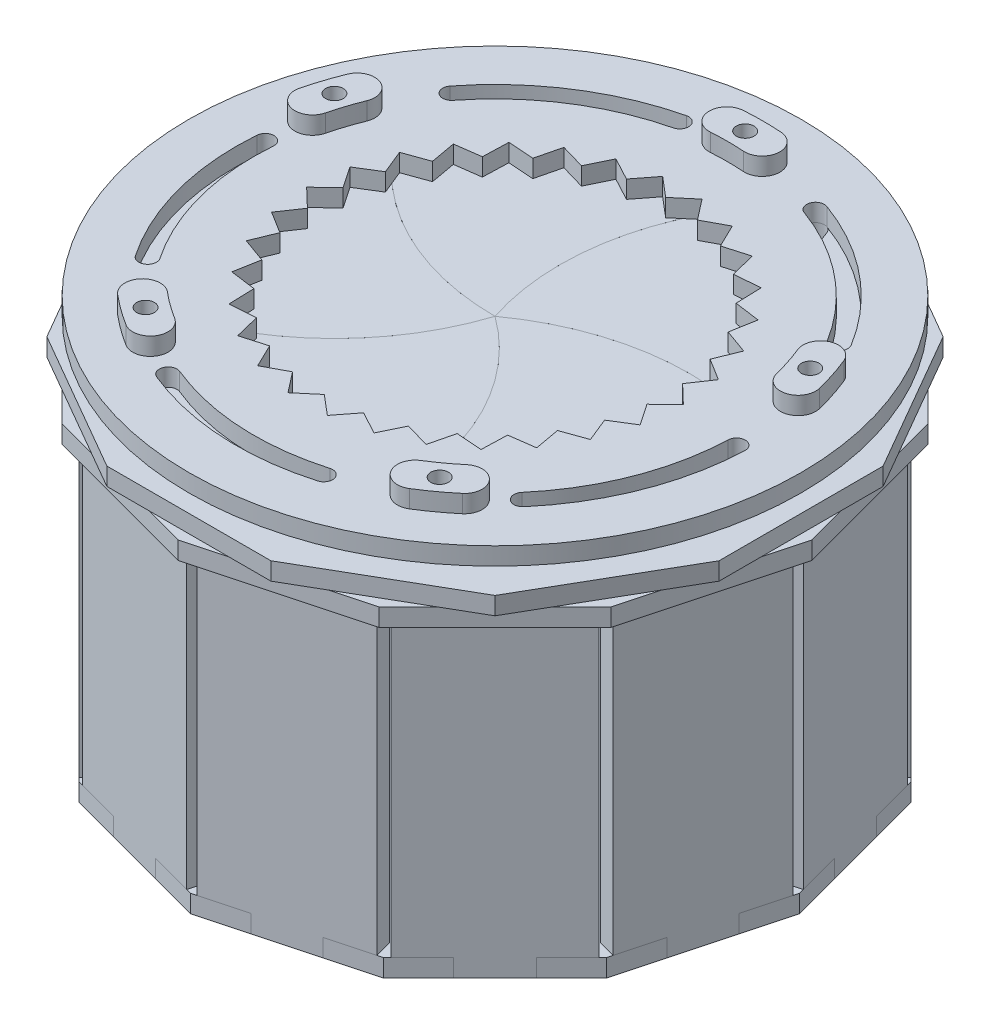
from build123d import *

# Parameters (mm, degrees)
SKETCH4_R             = 1.5
BOSS_EXTRUDE1_DEPTH   = 3
SKETCH5_R             = 52
SKETCH5_R_2           = 1.35
BOSS_EXTRUDE2_DEPTH   = 3
BOSS_EXTRUDE5_START   = -3
SKETCH8_R             = 1.35
SKETCH8_R_2           = 37
BOSS_EXTRUDE5_DEPTH   = 3
BOSS_EXTRUDE6_START   = -6
SKETCH6_R             = 37
SKETCH6_R_2           = 1.35
BOSS_EXTRUDE6_DEPTH   = 3
BOSS_EXTRUDE4_START   = 3
SKETCH7_R             = 1.5
BOSS_EXTRUDE4_DEPTH   = 3
SKETCH9_W             = 25
SKETCH9_H             = 50
SKETCH9_W_2           = 10
SKETCH9_H_2           = 3
BOSS_EXTRUDE7_DEPTH   = 3
CIRPATTERN1_COUNT     = 12
BOSS_EXTRUDE8_START   = -59
BOSS_EXTRUDE8_DEPTH   = 3
CIRPATTERN2_COUNT     = 5
CIRPATTERN3_COUNT     = 5
CUT_EXTRUDE1_START    = -3
CUT_EXTRUDE1_DEPTH    = 6
BOSS_EXTRUDE9_START   = -3
BOSS_EXTRUDE9_DEPTH   = 6
BOSS_EXTRUDE9_2_DEPTH = 6
BOSS_EXTRUDE9_3_DEPTH = 6
BOSS_EXTRUDE9_4_DEPTH = 6
BOSS_EXTRUDE9_5_DEPTH = 6


with BuildPart() as part:
    # Sketch4 → Boss-Extrude1 (new body)
    with BuildSketch(Plane(origin=(0, 0, 0), x_dir=(1, 0, 0), z_dir=(0, 1, 0))):
        with BuildLine():
            ThreePointArc((6.036679682, 38.114095483), (7.460052814, 42.658971774), (5.844359487, 47.139086353))
            ThreePointArc((5.844359487, 47.139086353), (-19.682082188, 43.230378679), (-39.391113444, 26.544117647))
            ThreePointArc((-39.391113444, 26.544117647), (-23.75, 7.25531955), (0, 0))
            ThreePointArc((0, 0), (-1.556852533, 19.781687025), (6.036679682, 38.114095483))
        make_face()
        with Locations(Location((0, 42.5, 0), (0, 0, 270))):
            Circle(SKETCH4_R, mode=Mode.SUBTRACT)
        with BuildLine():
            ThreePointArc((-2.401057807, 37.523065377), (-2.401057807, 39.644385721), (-4.522378151, 39.644385721))
            ThreePointArc((-4.522378151, 39.644385721), (-17.823735452, 30.756702916), (-33.513756179, 27.635763749))
            ThreePointArc((-33.513756179, 27.635763749), (-35.013756179, 26.135763749), (-33.513756179, 24.635763749))
            ThreePointArc((-33.513756179, 24.635763749), (-16.675685155, 27.985064319), (-2.401057807, 37.523065377))
        make_face(mode=Mode.SUBTRACT)
    extrude(amount=-BOSS_EXTRUDE1_DEPTH)


with BuildPart() as body_2:
    # Sketch5 → Boss-Extrude2 (new body)
    with BuildSketch(Plane(origin=(0, 0, 0), x_dir=(1, 0, 0), z_dir=(0, 1, 0))):
        with Locations(Location((0, 0, 0), (0, 0, 270))):
            Circle(SKETCH5_R)
        with Locations(Location((24.980873222, -34.383222261, 0), (0, 0, 270))):
            Circle(SKETCH5_R_2, mode=Mode.SUBTRACT)
        with Locations(Location((40.419901943, 13.133222261, 0), (0, 0, 270))):
            Circle(SKETCH5_R_2, mode=Mode.SUBTRACT)
        with Locations(Location((-24.980873222, -34.383222261, 0), (0, 0, 270))):
            Circle(SKETCH5_R_2, mode=Mode.SUBTRACT)
        with Locations(Location((-40.419901943, 13.133222261, 0), (0, 0, 270))):
            Circle(SKETCH5_R_2, mode=Mode.SUBTRACT)
        with Locations(Location((0, 42.5, 0), (0, 0, 270))):
            Circle(SKETCH5_R_2, mode=Mode.SUBTRACT)
        Polygon((-3.344910825, 31.824700652), (0, 29), (3.344910825, 31.824700652), (6.029439034, 28.366280421), (9.88854382, 30.433808521), (11.795362649, 26.492818272), (16, 27.712812921), (17.045772316, 23.461492837), (21.412179403, 23.780634415), (21.551199939, 19.404787584), (25.88854382, 18.809128073), (25.11473671, 14.5), (29.233454645, 13.015572578), (27.580638973, 8.961492837), (31.300723223, 6.653174106), (28.841134966, 3.031325435), (32, 0), (28.841134966, -3.031325435), (31.300723223, -6.653174106), (27.580638973, -8.961492837), (29.233454645, -13.015572578), (25.11473671, -14.5), (25.88854382, -18.809128073), (21.551199939, -19.404787584), (21.412179403, -23.780634415), (17.045772316, -23.461492837), (16, -27.712812921), (11.795362649, -26.492818272), (9.88854382, -30.433808521), (6.029439034, -28.366280421), (3.344910825, -31.824700652), (0, -29), (-3.344910825, -31.824700652), (-6.029439034, -28.366280421), (-9.88854382, -30.433808521), (-11.795362649, -26.492818272), (-16, -27.712812921), (-17.045772316, -23.461492837), (-21.412179403, -23.780634415), (-21.551199939, -19.404787584), (-25.88854382, -18.809128073), (-25.11473671, -14.5), (-29.233454645, -13.015572578), (-27.580638973, -8.961492837), (-31.300723223, -6.653174106), (-28.841134966, -3.031325435), (-32, 0), (-28.841134966, 3.031325435), (-31.300723223, 6.653174106), (-27.580638973, 8.961492837), (-29.233454645, 13.015572578), (-25.11473671, 14.5), (-25.88854382, 18.809128073), (-21.551199939, 19.404787584), (-21.412179403, 23.780634415), (-17.045772316, 23.461492837), (-16, 27.712812921), (-11.795362649, 26.492818272), (-9.88854382, 30.433808521), (-6.029439034, 28.366280421), align=None, mode=Mode.SUBTRACT)
        with BuildLine():
            ThreePointArc((-9.580064549, 39.865051903), (-22.19911899, 34.47026423), (-32.330917726, 25.213325029))
            ThreePointArc((-32.330917726, 25.213325029), (-34.4361949, 24.952925296), (-34.696594633, 27.05820247))
            ThreePointArc((-34.696594633, 27.05820247), (-23.823444769, 36.992478686), (-10.281044882, 42.78200692))
            ThreePointArc((-10.281044882, 42.78200692), (-8.472077207, 41.674019578), (-9.580064549, 39.865051903))
        make_face(mode=Mode.SUBTRACT)
        with BuildLine():
            ThreePointArc((33.464172761, -28.568324092), (41.0172051, -15.924474427), (43.97454707, -1.496399005))
            ThreePointArc((43.97454707, -1.496399005), (42.526428386, 0.053746884), (40.976282497, -1.3943718))
            ThreePointArc((40.976282497, -1.3943718), (38.22057748, -14.838714807), (31.182524618, -26.620483813))
            ThreePointArc((31.182524618, -26.620483813), (31.34942855, -28.735228024), (33.464172761, -28.568324092))
        make_face(mode=Mode.SUBTRACT)
        with BuildLine():
            ThreePointArc((15.01204239, 41.359866819), (13.090272758, 40.461645532), (13.988494045, 38.5398759))
            ThreePointArc((13.988494045, 38.5398759), (25.923264386, 31.764514219), (34.953514632, 21.430161336))
            ThreePointArc((34.953514632, 21.430161336), (37.016332046, 20.935404508), (37.511088873, 22.998221921))
            ThreePointArc((37.511088873, 22.998221921), (27.82008861, 34.088746966), (15.01204239, 41.359866819))
        make_face(mode=Mode.SUBTRACT)
        with BuildLine():
            ThreePointArc((-43.86512405, 3.442512463), (-42.543787206, -11.22613781), (-36.455717167, -24.636978018))
            ThreePointArc((-36.455717167, -24.636978018), (-34.373011649, -25.03988958), (-33.970100087, -22.957184063))
            ThreePointArc((-33.970100087, -22.957184063), (-39.643074442, -10.460719323), (-40.874320138, 3.207795704))
            ThreePointArc((-40.874320138, 3.207795704), (-42.252363715, 4.82055604), (-43.86512405, 3.442512463))
        make_face(mode=Mode.SUBTRACT)
        with BuildLine():
            ThreePointArc((-15.681654563, -37.882525129), (-2.301648434, -40.935344319), (11.336241271, -39.401645065))
            ThreePointArc((11.336241271, -39.401645065), (13.192505405, -40.428428131), (12.16572234, -42.284692265))
            ThreePointArc((12.16572234, -42.284692265), (-2.470061734, -43.930613415), (-16.829092702, -40.654417212))
            ThreePointArc((-16.829092702, -40.654417212), (-17.641319674, -38.694752101), (-15.681654563, -37.882525129))
        make_face(mode=Mode.SUBTRACT)
    extrude(amount=BOSS_EXTRUDE2_DEPTH)


with BuildPart() as body_3:
    # Sketch8 → Boss-Extrude5 (new body)
    with BuildSketch(Plane(origin=(0, 0, 0), x_dir=(1, 0, 0), z_dir=(0, 1, 0)).offset(BOSS_EXTRUDE5_START)):
        Polygon((13.933358006, 52), (-13.933358006, 52), (-38.066641994, 38.066641994), (-52, 13.933358006), (-52, -13.933358006), (-38.066641994, -38.066641994), (-13.933358006, -52), (13.933358006, -52), (38.066641994, -38.066641994), (52, -13.933358006), (52, 13.933358006), (38.066641994, 38.066641994), align=None)
        with Locations(Location((14.500268217, 39.949871359, 0), (0, 0, 270))):
            Circle(SKETCH8_R, mode=Mode.SUBTRACT)
        with Locations(Location((42.475414784, -1.445385403, 0), (0, 0, 270))):
            Circle(SKETCH8_R, mode=Mode.SUBTRACT)
        with Locations(Location((11.750981805, -40.843168665, 0), (0, 0, 270))):
            Circle(SKETCH8_R, mode=Mode.SUBTRACT)
        with Locations(Location((-35.212908627, -23.79708104, 0), (0, 0, 270))):
            Circle(SKETCH8_R, mode=Mode.SUBTRACT)
        with Locations(Location((-33.513756179, 26.135763749, 0), (0, 0, 270))):
            Circle(SKETCH8_R, mode=Mode.SUBTRACT)
        with Locations(Location((0, 0, 0), (0, 0, 270))):
            Circle(SKETCH8_R_2, mode=Mode.SUBTRACT)
    extrude(amount=-BOSS_EXTRUDE5_DEPTH)


with BuildPart() as body_4:
    # Sketch6 → Boss-Extrude6 (new body)
    with BuildSketch(Plane(origin=(0, 0, 0), x_dir=(1, 0, 0), z_dir=(0, 1, 0)).offset(BOSS_EXTRUDE6_START)):
        Polygon((46.621924553, -26.917180691), (53.834361381, 0), (46.621924553, 26.917180691), (26.917180691, 46.621924553), (0, 53.834361381), (-26.917180691, 46.621924553), (-46.621924553, 26.917180691), (-53.834361381, 0), (-46.621924553, -26.917180691), (-26.917180691, -46.621924553), (0, -53.834361381), (26.917180691, -46.621924553), align=None)
        with Locations(Location((0, 0, 0), (0, 0, 270))):
            Circle(SKETCH6_R, mode=Mode.SUBTRACT)
        with Locations(Location((-33.513756179, 26.135763749, 0), (0, 0, 270))):
            Circle(SKETCH6_R_2, mode=Mode.SUBTRACT)
        with Locations(Location((14.500268217, 39.949871359, 0), (0, 0, 270))):
            Circle(SKETCH6_R_2, mode=Mode.SUBTRACT)
        with Locations(Location((42.475414784, -1.445385403, 0), (0, 0, 270))):
            Circle(SKETCH6_R_2, mode=Mode.SUBTRACT)
        with Locations(Location((11.750981805, -40.843168665, 0), (0, 0, 270))):
            Circle(SKETCH6_R_2, mode=Mode.SUBTRACT)
        with Locations(Location((-35.212908627, -23.79708104, 0), (0, 0, 270))):
            Circle(SKETCH6_R_2, mode=Mode.SUBTRACT)
        Polygon((17.770581387, 47.002196089), (8.111323124, 49.59038654), (7.334865988, 46.692609061), (16.994124251, 44.10441861), align=None, mode=Mode.SUBTRACT)
        Polygon((46.692609061, 7.334865988), (49.59038654, 8.111323124), (47.002196089, 17.770581387), (44.10441861, 16.994124251), align=None, mode=Mode.SUBTRACT)
        Polygon((36.769552622, 29.69848481), (38.890872965, 31.819805153), (31.819805153, 38.890872965), (29.69848481, 36.769552622), align=None, mode=Mode.SUBTRACT)
        Polygon((29.69848481, -36.769552622), (31.819805153, -38.890872965), (38.890872965, -31.819805153), (36.769552622, -29.69848481), align=None, mode=Mode.SUBTRACT)
        Polygon((44.10441861, -16.994124251), (47.002196089, -17.770581387), (49.59038654, -8.111323124), (46.692609061, -7.334865988), align=None, mode=Mode.SUBTRACT)
        Polygon((-36.769552622, -29.69848481), (-38.890872965, -31.819805153), (-31.819805153, -38.890872965), (-29.69848481, -36.769552622), align=None, mode=Mode.SUBTRACT)
        Polygon((-16.994124251, -44.10441861), (-17.770581387, -47.002196089), (-8.111323124, -49.59038654), (-7.334865988, -46.692609061), align=None, mode=Mode.SUBTRACT)
        Polygon((16.994124251, -44.10441861), (7.334865988, -46.692609061), (8.111323124, -49.59038654), (17.770581387, -47.002196089), align=None, mode=Mode.SUBTRACT)
        Polygon((-29.69848481, 36.769552622), (-31.819805153, 38.890872965), (-38.890872965, 31.819805153), (-36.769552622, 29.69848481), align=None, mode=Mode.SUBTRACT)
        Polygon((-44.10441861, 16.994124251), (-47.002196089, 17.770581387), (-49.59038654, 8.111323124), (-46.692609061, 7.334865988), align=None, mode=Mode.SUBTRACT)
        Polygon((-46.692609061, -7.334865988), (-49.59038654, -8.111323124), (-47.002196089, -17.770581387), (-44.10441861, -16.994124251), align=None, mode=Mode.SUBTRACT)
        Polygon((-7.334865988, 46.692609061), (-8.111323124, 49.59038654), (-17.770581387, 47.002196089), (-16.994124251, 44.10441861), align=None, mode=Mode.SUBTRACT)
    extrude(amount=-BOSS_EXTRUDE6_DEPTH)


with BuildPart() as body_5:
    # Sketch7 → Boss-Extrude4 (new body)
    with BuildSketch(Plane(origin=(0, 0, 0), x_dir=(1, 0, 0), z_dir=(0, 1, 0)).offset(BOSS_EXTRUDE4_START)):
        with BuildLine():
            ThreePointArc((3.211764706, 45.386502041), (0, 45.5), (-3.211764706, 45.386502041))
            ThreePointArc((-3.211764706, 45.386502041), (-5.992516618, 42.182220717), (-2.788235294, 39.401468804))
            ThreePointArc((-2.788235294, 39.401468804), (0, 39.5), (2.788235294, 39.401468804))
            ThreePointArc((2.788235294, 39.401468804), (5.992516618, 42.182220717), (3.211764706, 45.386502041))
        make_face()
        with Locations(Location((0, 42.5, 0), (0, 0, 270))):
            Circle(SKETCH7_R, mode=Mode.SUBTRACT)
    extrude(amount=BOSS_EXTRUDE4_DEPTH)


with BuildPart() as body_6:
    # Sketch9 → Boss-Extrude7 (new body)
    with BuildSketch(Plane(origin=(-12.16449512, 0, -45.398513836), x_dir=(-0.9659258262890682, 0, 0.25881904510252124), z_dir=(-0.25881904510252124, 0, -0.9659258262890682))):
        with Locations((0, -34)):
            Rectangle(SKETCH9_W, SKETCH9_H)
        with Locations((0, -7.5)):
            Rectangle(SKETCH9_W_2, SKETCH9_H_2)
        with Locations((0, -60.5)):
            Rectangle(SKETCH9_W_2, SKETCH9_H_2)
    extrude(amount=BOSS_EXTRUDE7_DEPTH)


with BuildPart() as cirpattern1_1:
    # CirPattern1: pattern copy
    add(body_6.part.rotate(Axis((0, 0, 0), (0, 1, 0)), 1 * 360 / CIRPATTERN1_COUNT))


with BuildPart() as cirpattern1_2:
    # CirPattern1: pattern copy
    add(body_6.part.rotate(Axis((0, 0, 0), (0, 1, 0)), 2 * 360 / CIRPATTERN1_COUNT))


with BuildPart() as cirpattern1_3:
    # CirPattern1: pattern copy
    add(body_6.part.rotate(Axis((0, 0, 0), (0, 1, 0)), 3 * 360 / CIRPATTERN1_COUNT))


with BuildPart() as cirpattern1_4:
    # CirPattern1: pattern copy
    add(body_6.part.rotate(Axis((0, 0, 0), (0, 1, 0)), 4 * 360 / CIRPATTERN1_COUNT))


with BuildPart() as cirpattern1_5:
    # CirPattern1: pattern copy
    add(body_6.part.rotate(Axis((0, 0, 0), (0, 1, 0)), 5 * 360 / CIRPATTERN1_COUNT))


with BuildPart() as cirpattern1_6:
    # CirPattern1: pattern copy
    add(body_6.part.rotate(Axis((0, 0, 0), (0, 1, 0)), 6 * 360 / CIRPATTERN1_COUNT))


with BuildPart() as cirpattern1_7:
    # CirPattern1: pattern copy
    add(body_6.part.rotate(Axis((0, 0, 0), (0, 1, 0)), 7 * 360 / CIRPATTERN1_COUNT))


with BuildPart() as cirpattern1_8:
    # CirPattern1: pattern copy
    add(body_6.part.rotate(Axis((0, 0, 0), (0, 1, 0)), 8 * 360 / CIRPATTERN1_COUNT))


with BuildPart() as cirpattern1_9:
    # CirPattern1: pattern copy
    add(body_6.part.rotate(Axis((0, 0, 0), (0, 1, 0)), 9 * 360 / CIRPATTERN1_COUNT))


with BuildPart() as cirpattern1_10:
    # CirPattern1: pattern copy
    add(body_6.part.rotate(Axis((0, 0, 0), (0, 1, 0)), 10 * 360 / CIRPATTERN1_COUNT))


with BuildPart() as cirpattern1_11:
    # CirPattern1: pattern copy
    add(body_6.part.rotate(Axis((0, 0, 0), (0, 1, 0)), 11 * 360 / CIRPATTERN1_COUNT))


with BuildPart() as body_18:
    # Sketch10 → Boss-Extrude8 (new body)
    with BuildSketch(Plane(origin=(0, 0, 0), x_dir=(1, 0, 0), z_dir=(0, 1, 0)).offset(BOSS_EXTRUDE8_START)):
        Polygon((-8.111323124, -49.59038654), (0, -51.763809021), (8.111323124, -49.59038654), (7.334865988, -46.692609061), (16.994124251, -44.10441861), (17.770581387, -47.002196089), (25.88190451, -44.828773608), (31.819805153, -38.890872965), (29.69848481, -36.769552622), (36.769552622, -29.69848481), (38.890872965, -31.819805153), (44.828773608, -25.88190451), (47.002196089, -17.770581387), (44.10441861, -16.994124251), (46.692609061, -7.334865988), (49.59038654, -8.111323124), (51.763809021, 0), (49.59038654, 8.111323124), (46.692609061, 7.334865988), (44.10441861, 16.994124251), (47.002196089, 17.770581387), (44.828773608, 25.88190451), (38.890872965, 31.819805153), (36.769552622, 29.69848481), (29.69848481, 36.769552622), (31.819805153, 38.890872965), (25.88190451, 44.828773608), (17.770581387, 47.002196089), (16.994124251, 44.10441861), (7.334865988, 46.692609061), (8.111323124, 49.59038654), (0, 51.763809021), (-8.111323124, 49.59038654), (-7.334865988, 46.692609061), (-16.994124251, 44.10441861), (-17.770581387, 47.002196089), (-25.88190451, 44.828773608), (-31.819805153, 38.890872965), (-29.69848481, 36.769552622), (-36.769552622, 29.69848481), (-38.890872965, 31.819805153), (-44.828773608, 25.88190451), (-47.002196089, 17.770581387), (-44.10441861, 16.994124251), (-46.692609061, 7.334865988), (-49.59038654, 8.111323124), (-51.763809021, 0), (-49.59038654, -8.111323124), (-46.692609061, -7.334865988), (-44.10441861, -16.994124251), (-47.002196089, -17.770581387), (-44.828773608, -25.88190451), (-38.890872965, -31.819805153), (-36.769552622, -29.69848481), (-29.69848481, -36.769552622), (-31.819805153, -38.890872965), (-25.88190451, -44.828773608), (-17.770581387, -47.002196089), (-16.994124251, -44.10441861), (-7.334865988, -46.692609061), align=None)
    extrude(amount=-BOSS_EXTRUDE8_DEPTH)


with BuildPart() as cirpattern2_1:
    # CirPattern2: pattern copy
    add(part.part.rotate(Axis((0, 0, 0), (0, 1, 0)), 1 * 360 / CIRPATTERN2_COUNT))


with BuildPart() as cirpattern2_2:
    # CirPattern2: pattern copy
    add(part.part.rotate(Axis((0, 0, 0), (0, 1, 0)), 2 * 360 / CIRPATTERN2_COUNT))


with BuildPart() as cirpattern2_3:
    # CirPattern2: pattern copy
    add(part.part.rotate(Axis((0, 0, 0), (0, 1, 0)), 3 * 360 / CIRPATTERN2_COUNT))


with BuildPart() as cirpattern2_4:
    # CirPattern2: pattern copy
    add(part.part.rotate(Axis((0, 0, 0), (0, 1, 0)), 4 * 360 / CIRPATTERN2_COUNT))


with BuildPart() as cirpattern3_1:
    # CirPattern3: pattern copy
    add(body_5.part.rotate(Axis((0, 0, 0), (0, 1, 0)), 1 * 360 / CIRPATTERN3_COUNT))


with BuildPart() as cirpattern3_2:
    # CirPattern3: pattern copy
    add(body_5.part.rotate(Axis((0, 0, 0), (0, 1, 0)), 2 * 360 / CIRPATTERN3_COUNT))


with BuildPart() as cirpattern3_3:
    # CirPattern3: pattern copy
    add(body_5.part.rotate(Axis((0, 0, 0), (0, 1, 0)), 3 * 360 / CIRPATTERN3_COUNT))


with BuildPart() as cirpattern3_4:
    # CirPattern3: pattern copy
    add(body_5.part.rotate(Axis((0, 0, 0), (0, 1, 0)), 4 * 360 / CIRPATTERN3_COUNT))


with BuildPart() as cut_extrude1_tool:
    # Sketch11 → Cut-Extrude1 (new body)
    with BuildSketch(Plane(origin=(0, 0, 0), x_dir=(1, 0, 0), z_dir=(0, 1, 0)).offset(CUT_EXTRUDE1_START)):
        Polygon((7.66069388, 38.779037756), (4.697628858, 39.248341151), (5.479801183, 44.186782854), (8.442866205, 43.717479459), align=None)
        Polygon((39.248341151, 4.697628858), (38.779037756, 7.66069388), (43.717479459, 8.442866205), (44.186782854, 5.479801183), align=None)
        Polygon((16.596114953, -35.875743455), (19.269134526, -34.513771956), (21.539087025, -38.968804577), (18.866067452, -40.330776076), align=None)
        Polygon((-28.991378029, -26.870057685), (-26.870057685, -28.991378029), (-30.405591591, -32.526911935), (-32.526911935, -30.405591591), align=None)
        Polygon((-34.513771956, 19.269134526), (-35.875743455, 16.596114953), (-40.330776076, 18.866067452), (-38.968804577, 21.539087025), align=None)
    extrude(amount=-CUT_EXTRUDE1_DEPTH)


with BuildPart() as body_3_1:
    add(body_3.part)

    # Cut-Extrude1: cut by cut_extrude1_tool
    add(cut_extrude1_tool.part, mode=Mode.SUBTRACT)


with BuildPart() as body_4_1:
    add(body_4.part)

    # Cut-Extrude1: cut by cut_extrude1_tool
    add(cut_extrude1_tool.part, mode=Mode.SUBTRACT)


with BuildPart() as body_27:
    # Sketch12 → Boss-Extrude9 (new body)
    with BuildSketch(Plane(origin=(0, 0, 0), x_dir=(1, 0, 0), z_dir=(0, 1, 0)).offset(BOSS_EXTRUDE9_START)):
        Polygon((4.697628858, 39.248341151), (7.66069388, 38.779037756), (8.442866205, 43.717479459), (5.479801183, 44.186782854), align=None)
    extrude(amount=-BOSS_EXTRUDE9_DEPTH)


with BuildPart() as body_28:
    # Sketch12 → Boss-Extrude9 2 (new body)
    with BuildSketch(Plane(origin=(0, 0, 0), x_dir=(1, 0, 0), z_dir=(0, 1, 0)).offset(BOSS_EXTRUDE9_START)):
        Polygon((-35.875743455, 16.596114953), (-34.513771956, 19.269134526), (-38.968804577, 21.539087025), (-40.330776076, 18.866067452), align=None)
    extrude(amount=-BOSS_EXTRUDE9_2_DEPTH)


with BuildPart() as body_29:
    # Sketch12 → Boss-Extrude9 3 (new body)
    with BuildSketch(Plane(origin=(0, 0, 0), x_dir=(1, 0, 0), z_dir=(0, 1, 0)).offset(BOSS_EXTRUDE9_START)):
        Polygon((-26.870057685, -28.991378029), (-28.991378029, -26.870057685), (-32.526911935, -30.405591591), (-30.405591591, -32.526911935), align=None)
    extrude(amount=-BOSS_EXTRUDE9_3_DEPTH)


with BuildPart() as body_30:
    # Sketch12 → Boss-Extrude9 4 (new body)
    with BuildSketch(Plane(origin=(0, 0, 0), x_dir=(1, 0, 0), z_dir=(0, 1, 0)).offset(BOSS_EXTRUDE9_START)):
        Polygon((19.269134526, -34.513771956), (16.596114953, -35.875743455), (18.866067452, -40.330776076), (21.539087025, -38.968804577), align=None)
    extrude(amount=-BOSS_EXTRUDE9_4_DEPTH)


with BuildPart() as body_31:
    # Sketch12 → Boss-Extrude9 5 (new body)
    with BuildSketch(Plane(origin=(0, 0, 0), x_dir=(1, 0, 0), z_dir=(0, 1, 0)).offset(BOSS_EXTRUDE9_START)):
        Polygon((44.186782854, 5.479801183), (43.717479459, 8.442866205), (38.779037756, 7.66069388), (39.248341151, 4.697628858), align=None)
    extrude(amount=-BOSS_EXTRUDE9_5_DEPTH)


solid = Compound([part.part, body_2.part, body_5.part, body_6.part, cirpattern1_1.part, cirpattern1_2.part, cirpattern1_3.part, cirpattern1_4.part, cirpattern1_5.part, cirpattern1_6.part, cirpattern1_7.part, cirpattern1_8.part, cirpattern1_9.part, cirpattern1_10.part, cirpattern1_11.part, body_18.part, cirpattern2_1.part, cirpattern2_2.part, cirpattern2_3.part, cirpattern2_4.part, cirpattern3_1.part, cirpattern3_2.part, cirpattern3_3.part, cirpattern3_4.part, body_3_1.part, body_4_1.part, body_27.part, body_28.part, body_29.part, body_30.part, body_31.part])
